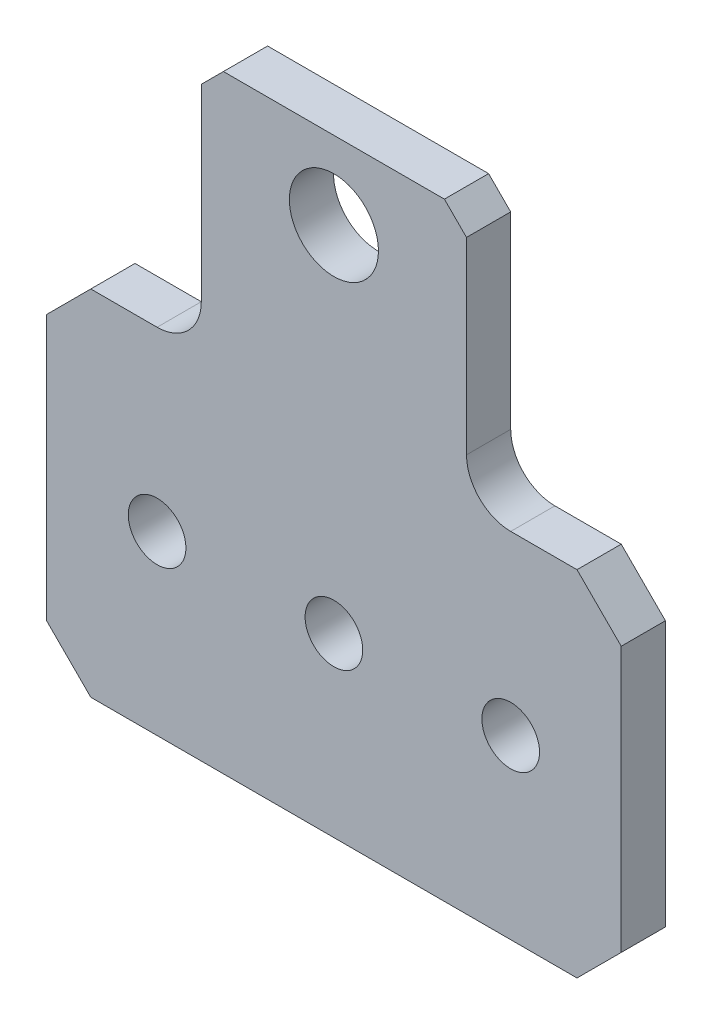
from build123d import *

# Parameters (mm, degrees)
SKETCH1_R           = 3.2004
SKETCH1_R_2         = 2.0701
BOSS_EXTRUDE1_DEPTH = 3.175
SKETCH2_W           = 33.106994052
SKETCH2_H           = 45.21414564
CUT_EXTRUDE1_DEPTH  = 46.916296315


with BuildPart() as part:
    # Sketch1 → Boss-Extrude1 (new body)
    with BuildSketch(Plane(origin=(0, 0, 0), x_dir=(-1, 0, 0), z_dir=(0, 0, -1))):
        with BuildLine():
            Line((-17.4625, -15.494), (-20.6375, -18.669))
            Line((-20.6375, -18.669), (-20.6375, -37.719))
            Line((-20.6375, -37.719), (-17.4625, -40.894))
            Line((-17.4625, -40.894), (17.4625, -40.894))
            Line((17.4625, -40.894), (20.6375, -37.719))
            Line((20.6375, -37.719), (20.6375, -18.669))
            Line((20.6375, -18.669), (17.4625, -15.494))
            Line((17.4625, -15.494), (12.7, -15.494))
            ThreePointArc((12.7, -15.494), (10.45493597, -14.56406403), (9.525, -12.319))
            Line((9.525, -12.319), (9.525, 1.2065))
            Line((9.525, 1.2065), (7.9375, 2.794))
            Line((7.9375, 2.794), (9.525, 4.3815))
            Line((9.525, 4.3815), (9.525, 37.719))
            Line((9.525, 37.719), (6.35, 40.894))
            Line((6.35, 40.894), (-6.35, 40.894))
            Line((-6.35, 40.894), (-9.525, 37.719))
            Line((-9.525, 37.719), (-9.525, 4.3815))
            Line((-9.525, 4.3815), (-7.9375, 2.794))
            Line((-7.9375, 2.794), (-9.525, 1.2065))
            Line((-9.525, 1.2065), (-9.525, -12.319))
            ThreePointArc((-9.525, -12.319), (-10.45493597, -14.56406403), (-12.7, -15.494))
            Line((-12.7, -15.494), (-17.4625, -15.494))
        make_face()
        with Locations(Location((0, 35.306, 0), (0, 0, 180))):
            Circle(SKETCH1_R, mode=Mode.SUBTRACT)
        with Locations(Location((0, -2.794, 0), (0, 0, 180))):
            Circle(SKETCH1_R, mode=Mode.SUBTRACT)
        with Locations(Location((12.7, -28.194, 0), (0, 0, 180))):
            Circle(SKETCH1_R_2, mode=Mode.SUBTRACT)
        with Locations(Location((-12.7, -28.194, 0), (0, 0, 180))):
            Circle(SKETCH1_R_2, mode=Mode.SUBTRACT)
        with Locations(Location((0, -28.194, 0), (0, 0, 180))):
            Circle(SKETCH1_R_2, mode=Mode.SUBTRACT)
    extrude(amount=-BOSS_EXTRUDE1_DEPTH)

    # Sketch2 → Cut-Extrude1 (cut, through all)
    with BuildSketch(Plane.XY.offset(3.175)):
        with Locations((5.708102423, 25.40107282)):
            Rectangle(SKETCH2_W, SKETCH2_H)
    extrude(amount=-CUT_EXTRUDE1_DEPTH, mode=Mode.SUBTRACT)


solid = part.part
